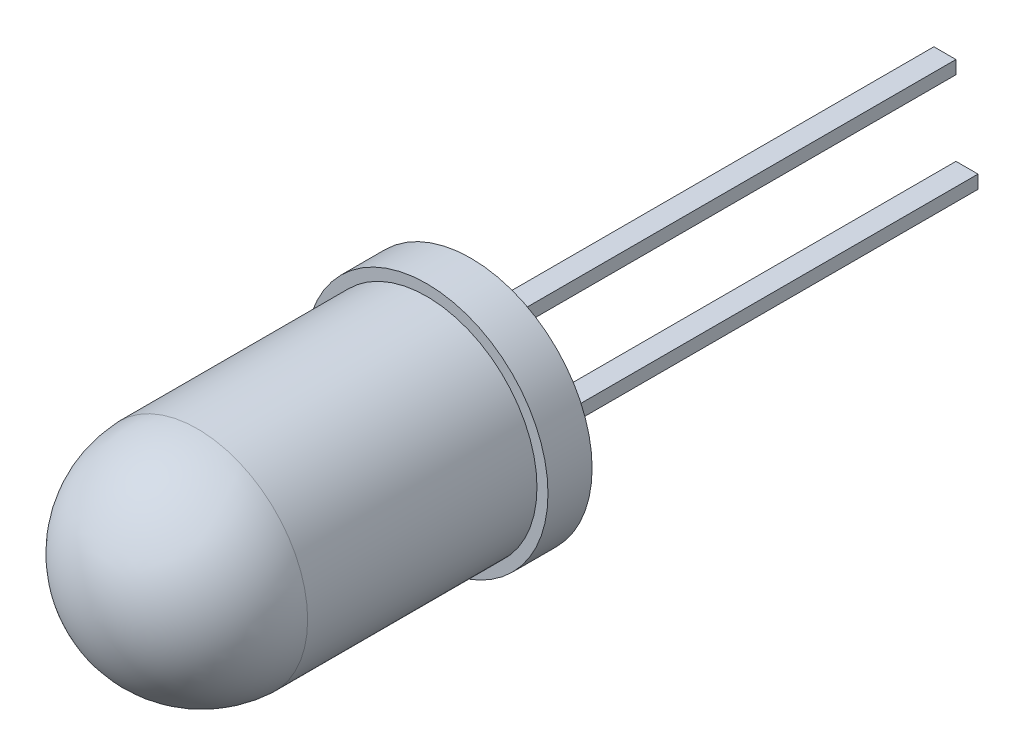
from build123d import *

# Parameters (mm, degrees)
SKETCH1_R           = 2.5
BOSS_EXTRUDE1_DEPTH = 2.6
BOSS_EXTRUDE2_START = -2.6
SKETCH2_R           = 2.75
BOSS_EXTRUDE2_DEPTH = 1
DOME1_FACE_RADIUS   = 2.5
DOME1_HEIGHT        = 2.4
BOSS_EXTRUDE3_START = -3.6
SKETCH3_W           = 0.5
SKETCH3_H           = 0.3
BOSS_EXTRUDE3_DEPTH = 12
CUT_EXTRUDE1_START  = -15.6
SKETCH4_W           = 0.5
SKETCH4_H           = 0.3
CUT_EXTRUDE1_DEPTH  = 2


with BuildPart() as part:
    # Sketch1 → Boss-Extrude1 (new, symmetric)
    with BuildSketch(Plane.XY):
        Circle(SKETCH1_R)
    extrude(amount=BOSS_EXTRUDE1_DEPTH, both=True)

    # Sketch2 → Boss-Extrude2 (add)
    with BuildSketch(Plane.XY.offset(BOSS_EXTRUDE2_START)):
        Circle(SKETCH2_R)
    extrude(amount=-BOSS_EXTRUDE2_DEPTH)

    # Dome1: a dome of height H over a round flat face of radius A is a cap of a sphere of radius (A * A + H * H) / (2 * H)
    dome1_r = (DOME1_FACE_RADIUS * DOME1_FACE_RADIUS + DOME1_HEIGHT * DOME1_HEIGHT) / (2 * DOME1_HEIGHT)
    dome1_base = Plane((0, 0, 2.6), z_dir=(0, 0, 1))
    with Locations(dome1_base.offset(DOME1_HEIGHT - dome1_r)):
        dome1_ball = Sphere(dome1_r, mode=Mode.PRIVATE)
    add(split(dome1_ball, bisect_by=dome1_base, keep=Keep.TOP, mode=Mode.PRIVATE))

    # Sketch3 → Boss-Extrude3 (add)
    with BuildSketch(Plane.XY.offset(BOSS_EXTRUDE3_START)):
        with Locations((1.25, 0)):
            Rectangle(SKETCH3_W, SKETCH3_H)
        with Locations((-1.25, 0)):
            Rectangle(SKETCH3_W, SKETCH3_H)
    extrude(amount=-BOSS_EXTRUDE3_DEPTH)

    # Sketch4 → Cut-Extrude1 (cut)
    with BuildSketch(Plane.XY.offset(CUT_EXTRUDE1_START)):
        with Locations((1.25, 0)):
            Rectangle(SKETCH4_W, SKETCH4_H)
    extrude(amount=CUT_EXTRUDE1_DEPTH, mode=Mode.SUBTRACT)


solid = part.part
